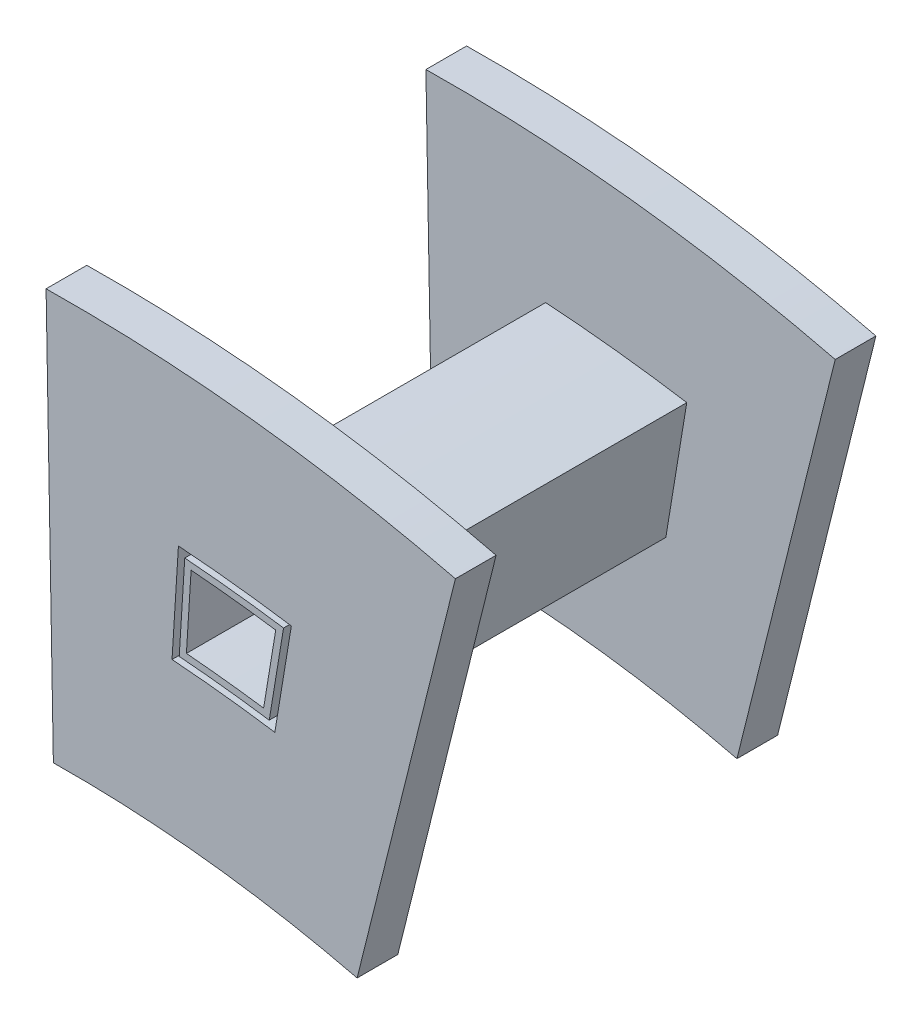
from build123d import *

# Parameters (mm, degrees)
BOSS_EXTRUDE1_START      = 0.1
BOSS_EXTRUDE1_DEPTH      = 3
EXTRUDE_THIN1_DEPTH      = 25
BOSS_EXTRUDE2_DEPTH      = 3
BOSS_EXTRUDE3_DEPTH      = 25
BOSS_EXTRUDE4_DEPTH      = 3
BOSS_EXTRUDE4_DEPTH_BACK = 28


with BuildPart() as part:
    # Sketch1 → Boss-Extrude1 (new body)
    with BuildSketch(Plane.XY.offset(16.7429656).offset(BOSS_EXTRUDE1_START)):
        with BuildLine():
            Line((-5.770857241, 84.303922359), (-5.233937167, 54.308727464))
            ThreePointArc((-5.233937167, 54.308727464), (6.042241893, 53.741784506), (17.158709141, 51.767501232))
            Line((17.158709141, 51.767501232), (24.403411874, 80.879599787))
            ThreePointArc((24.403411874, 80.879599787), (9.425037263, 83.550126361), (-5.770857241, 84.303922359))
        make_face()
        with BuildLine():
            Line((12.309401555, 71.819693694), (11.092056694, 64.418608994))
            ThreePointArc((11.092056694, 64.418608994), (7.310803865, 64.920033498), (3.513347634, 65.278677697))
            Line((3.513347634, 65.278677697), (3.985423015, 72.764339196))
            ThreePointArc((3.985423015, 72.764339196), (8.156511847, 72.372199493), (12.309401555, 71.819693694))
        make_face(mode=Mode.SUBTRACT)
    extrude(amount=BOSS_EXTRUDE1_DEPTH)


with BuildPart() as body_2:
    # Sketch2 → Extrude-Thin1 (new body)
    with BuildSketch(Plane.XY.offset(19.8429656)):
        with BuildLine():
            Line((3.050778794, 73.832181223), (2.452857374, 64.350989175))
            ThreePointArc((2.452857374, 64.350989175), (7.198042801, 63.926411366), (11.917698616, 63.276873034))
            Line((11.917698616, 63.276873034), (13.459563743, 72.650941767))
            ThreePointArc((13.459563743, 72.650941767), (8.269272911, 73.365821625), (3.050778794, 73.832181223))
        make_face()
        with BuildLine():
            Line((3.985423015, 72.764339196), (3.513347634, 65.278677697))
            ThreePointArc((3.513347634, 65.278677697), (7.310803865, 64.920033498), (11.092056694, 64.418608994))
            Line((11.092056694, 64.418608994), (12.309401555, 71.819693694))
            ThreePointArc((12.309401555, 71.819693694), (8.156511847, 72.372199493), (3.985423015, 72.764339196))
        make_face(mode=Mode.SUBTRACT)
    extrude(amount=EXTRUDE_THIN1_DEPTH)

    # Sketch4 → Boss-Extrude3 (add)
    with BuildSketch(Plane(origin=(0, 0, 19.8429656), x_dir=(-1, 0, 0), z_dir=(0, 0, -1))):
        with BuildLine():
            Line((-3.985423015, 72.764339196), (-3.513347634, 65.278677697))
            ThreePointArc((-3.513347634, 65.278677697), (-7.310803865, 64.920033498), (-11.092056694, 64.418608994))
            Line((-11.092056694, 64.418608994), (-12.309401555, 71.819693694))
            ThreePointArc((-12.309401555, 71.819693694), (-8.156511847, 72.372199493), (-3.985423015, 72.764339196))
        make_face()
        with BuildLine():
            Line((-4.573231318, 66.196747792), (-4.919474926, 71.687104939))
            ThreePointArc((-4.919474926, 71.687104939), (-8.043750783, 71.37857736), (-11.15771197, 70.979159509))
            Line((-11.15771197, 70.979159509), (-10.26485059, 65.550835201))
            ThreePointArc((-10.26485059, 65.550835201), (-7.42356493, 65.913655631), (-4.573231318, 66.196747792))
        make_face(mode=Mode.SUBTRACT)
    extrude(amount=-BOSS_EXTRUDE3_DEPTH)

    # Sketch5 → Boss-Extrude4 (add, two sides: drawn at the far end of the back side and taken through both)
    with BuildSketch(Plane(origin=(0, 0, 19.8429656), x_dir=(-1, 0, 0), z_dir=(0, 0, -1)).offset(-BOSS_EXTRUDE4_DEPTH_BACK)):
        with BuildLine():
            Line((-4.043364195, 65.738897559), (-4.452524049, 72.226912575))
            ThreePointArc((-4.452524049, 72.226912575), (-8.100131315, 71.875388426), (-11.733750367, 71.400603658))
            Line((-11.733750367, 71.400603658), (-10.678646321, 64.985893525))
            ThreePointArc((-10.678646321, 64.985893525), (-7.367184398, 65.416844564), (-4.043364195, 65.738897559))
        make_face()
        with BuildLine():
            Line((-4.573231318, 66.196747792), (-4.919474926, 71.687104939))
            ThreePointArc((-4.919474926, 71.687104939), (-8.043750783, 71.37857736), (-11.15771197, 70.979159509))
            Line((-11.15771197, 70.979159509), (-10.26485059, 65.550835201))
            ThreePointArc((-10.26485059, 65.550835201), (-7.42356493, 65.913655631), (-4.573231318, 66.196747792))
        make_face(mode=Mode.SUBTRACT)
    extrude(amount=BOSS_EXTRUDE4_DEPTH + BOSS_EXTRUDE4_DEPTH_BACK)


with BuildPart() as body_3:
    # Sketch3 → Boss-Extrude2 (new body)
    with BuildSketch(Plane.XY.offset(44.8429656)):
        with BuildLine():
            Line((-5.770857241, 84.303922359), (-5.233937167, 54.308727464))
            ThreePointArc((-5.233937167, 54.308727464), (6.042241893, 53.741784506), (17.158709141, 51.767501232))
            Line((17.158709141, 51.767501232), (24.403411874, 80.879599787))
            ThreePointArc((24.403411874, 80.879599787), (9.425037263, 83.550126361), (-5.770857241, 84.303922359))
        make_face()
        with BuildLine():
            Line((11.092056694, 64.418608994), (12.309401555, 71.819693694))
            ThreePointArc((12.309401555, 71.819693694), (8.156511847, 72.372199493), (3.985423015, 72.764339196))
            Line((3.985423015, 72.764339196), (3.513347634, 65.278677697))
            ThreePointArc((3.513347634, 65.278677697), (7.310803865, 64.920033498), (11.092056694, 64.418608994))
        make_face(mode=Mode.SUBTRACT)
    extrude(amount=BOSS_EXTRUDE2_DEPTH)


solid = Compound([part.part, body_2.part, body_3.part])
